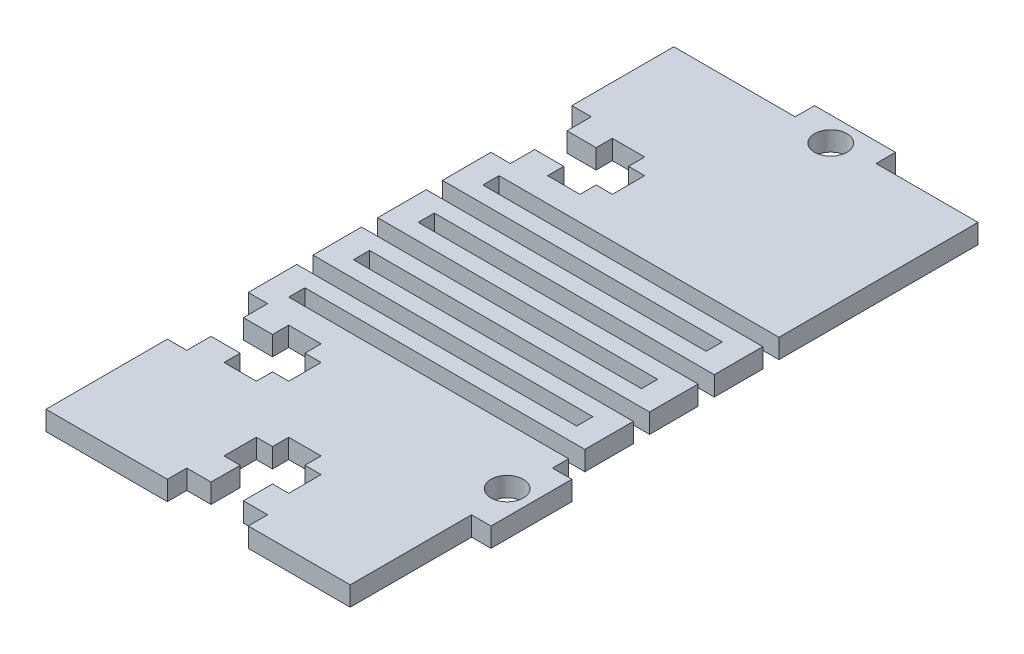
from build123d import *

# Parameters (mm, degrees)
BOSS_EXTRUDE1_DEPTH = 3.048
SKETCH2_W           = 4.572
SKETCH2_H           = 5.08
SKETCH2_W_2         = 5.08
SKETCH2_H_2         = 2.54
SKETCH2_W_3         = 2.54
SKETCH2_H_3         = 4.572
SKETCH2_R           = 2.54
CUT_EXTRUDE1_DEPTH  = 3.048
SKETCH3_W           = 12.7
SKETCH3_H           = 3.048
SKETCH3_W_2         = 44.704
SKETCH3_H_2         = 12.7
BOSS_EXTRUDE2_DEPTH = 3.048
BOSS_EXTRUDE3_START = -3.048
SKETCH4_R           = 2.54
BOSS_EXTRUDE3_DEPTH = 3.048
SKETCH5_R           = 2.54
SKETCH5_W           = 5.08
SKETCH5_H           = 2.54
SKETCH5_W_2         = 4.572
SKETCH5_H_2         = 5.08
SKETCH5_W_3         = 2.54
SKETCH5_W_4         = 43.942
CUT_EXTRUDE2_DEPTH  = 114.63313911


with BuildPart() as part:
    # Sketch1 → Boss-Extrude1 (new body)
    with BuildSketch(Plane(origin=(0, 0, 0), x_dir=(1, 0, 0), z_dir=(0, 1, 0))):
        Polygon((0, 19.05), (0, 0), (19.05, 0), (19.05, 3.048), (31.75, 3.048), (31.75, 0), (47.752, 0), (47.752, 19.05), (50.8, 19.05), (50.8, 31.75), (47.752, 31.75), (47.752, 47.752), (31.75, 47.752), (31.75, 50.8), (19.05, 50.8), (19.05, 47.752), (0, 47.752), (0, 31.75), (3.048, 31.75), (3.048, 19.05), align=None)
    extrude(amount=BOSS_EXTRUDE1_DEPTH)

    # Sketch2 → Cut-Extrude1 (cut)
    with BuildSketch(Plane(origin=(0, 3.048, 0), x_dir=(1, 0, 0), z_dir=(0, 1, 0))):
        with Locations((5.334, 25.4)):
            Rectangle(SKETCH2_W, SKETCH2_H)
        with Locations((10.16, 25.4)):
            Rectangle(SKETCH2_W_2, SKETCH2_H)
        with Locations((10.16, 29.21)):
            Rectangle(SKETCH2_W_2, SKETCH2_H_2)
        with Locations((13.97, 25.4)):
            Rectangle(SKETCH2_W_3, SKETCH2_H)
        with Locations((10.16, 21.59)):
            Rectangle(SKETCH2_W_2, SKETCH2_H_2)
        with Locations((25.4, 13.97)):
            Rectangle(SKETCH2_W_2, SKETCH2_H_2)
        with Locations((25.4, 10.16)):
            Rectangle(SKETCH2_W_2, SKETCH2_H)
        with Locations((29.21, 10.16)):
            Rectangle(SKETCH2_W_3, SKETCH2_H)
        with Locations((21.59, 10.16)):
            Rectangle(SKETCH2_W_3, SKETCH2_H)
        with Locations((25.4, 5.334)):
            Rectangle(SKETCH2_W_2, SKETCH2_H_3)
        with Locations(Location((46.99, 25.4, 0), (0, 0, 270))):
            Circle(SKETCH2_R)
        with Locations(Location((25.4, 46.99, 0), (0, 0, 270))):
            Circle(SKETCH2_R)
    extrude(amount=-CUT_EXTRUDE1_DEPTH, mode=Mode.SUBTRACT)

    # Sketch3 → Boss-Extrude2 (add)
    with BuildSketch(Plane(origin=(0, 3.048, 0), x_dir=(1, 0, 0), z_dir=(0, 1, 0))):
        with Locations((25.4, 100.076)):
            Rectangle(SKETCH3_W, SKETCH3_H)
        Polygon((3.048, 82.55), (47.752, 82.55), (47.752, 98.552), (31.75, 98.552), (19.05, 98.552), (0, 98.552), (0, 82.55), align=None)
        with Locations((25.4, 76.2)):
            Rectangle(SKETCH3_W_2, SKETCH3_H_2)
        Polygon((0, 69.85), (0, 47.752), (19.05, 47.752), (19.05, 50.8), (31.75, 50.8), (31.75, 47.752), (47.752, 47.752), (47.752, 69.85), (3.048, 69.85), align=None)
    extrude(amount=-BOSS_EXTRUDE2_DEPTH)

    # Sketch4 → Boss-Extrude3 (add)
    with BuildSketch(Plane(origin=(0, 0, 0), x_dir=(-1, 0, 0), z_dir=(0, -1, 0)).offset(BOSS_EXTRUDE3_START)):
        with Locations((-25.4, 46.99)):
            Circle(SKETCH4_R)
    extrude(amount=BOSS_EXTRUDE3_DEPTH)

    # Sketch5 → Cut-Extrude2 (cut, through all)
    with BuildSketch(Plane(origin=(0, 3.048, 0), x_dir=(1, 0, 0), z_dir=(0, 1, 0))):
        with Locations(Location((25.4, 97.79, 0), (0, 0, 270))):
            Circle(SKETCH5_R)
        with Locations((10.16, 80.01)):
            Rectangle(SKETCH5_W, SKETCH5_H)
        with Locations((5.334, 76.2)):
            Rectangle(SKETCH5_W_2, SKETCH5_H_2)
        with Locations((10.16, 76.2)):
            Rectangle(SKETCH5_W, SKETCH5_H_2)
        with Locations((13.97, 76.2)):
            Rectangle(SKETCH5_W_3, SKETCH5_H_2)
        with Locations((10.16, 72.39)):
            Rectangle(SKETCH5_W, SKETCH5_H)
        with Locations((25.781, 66.04)):
            Rectangle(SKETCH5_W_4, SKETCH5_H)
        with Locations((21.971, 60.96)):
            Rectangle(SKETCH5_W_4, SKETCH5_H)
        with Locations((25.781, 55.88)):
            Rectangle(SKETCH5_W_4, SKETCH5_H)
        with Locations((21.971, 50.8)):
            Rectangle(SKETCH5_W_4, SKETCH5_H)
        with Locations((25.781, 45.72)):
            Rectangle(SKETCH5_W_4, SKETCH5_H)
        with Locations((21.971, 40.64)):
            Rectangle(SKETCH5_W_4, SKETCH5_H)
        with Locations((25.781, 35.56)):
            Rectangle(SKETCH5_W_4, SKETCH5_H)
    extrude(amount=-CUT_EXTRUDE2_DEPTH, mode=Mode.SUBTRACT)


solid = part.part
